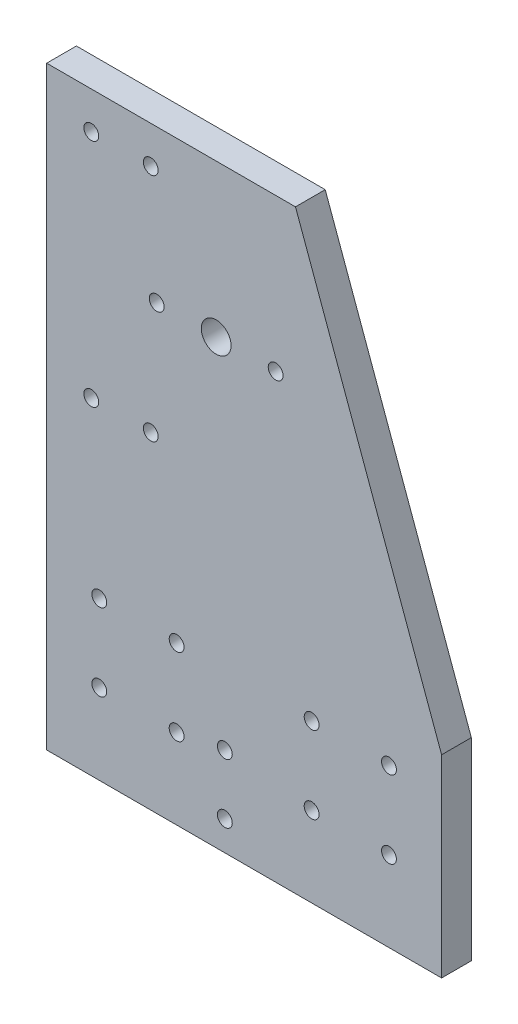
from build123d import *

# Parameters (mm, degrees)
SKETCH1_R           = 2.5
BOSS_EXTRUDE1_DEPTH = 10
SKETCH1_3_R         = 2.5
CUT_EXTRUDE1_DEPTH  = 5
SKETCH2_R           = 2.5
SKETCH2_R_2         = 5
CUT_EXTRUDE2_DEPTH  = 241.282833344


with BuildPart() as part:
    # Sketch1 → Boss-Extrude1 (new body)
    with BuildSketch(Plane.XY):
        Polygon((0, 200), (0, 0), (132.8, 0), (132.8, 65), (83.664018374, 200), align=None)
        with Locations((17.7, 27)):
            Circle(SKETCH1_R, mode=Mode.SUBTRACT)
        with Locations((43.7, 27)):
            Circle(SKETCH1_R, mode=Mode.SUBTRACT)
        with Locations((17.7, 53)):
            Circle(SKETCH1_R, mode=Mode.SUBTRACT)
        with Locations((43.7, 53)):
            Circle(SKETCH1_R, mode=Mode.SUBTRACT)
        with Locations((89.1, 27)):
            Circle(SKETCH1_R, mode=Mode.SUBTRACT)
        with Locations((115.1, 27)):
            Circle(SKETCH1_R, mode=Mode.SUBTRACT)
        with Locations((89.1, 53)):
            Circle(SKETCH1_R, mode=Mode.SUBTRACT)
        with Locations((115.1, 53)):
            Circle(SKETCH1_R, mode=Mode.SUBTRACT)
        with Locations((59.91, 9.92)):
            Circle(SKETCH1_R, mode=Mode.SUBTRACT)
        with Locations((59.91, 29.92)):
            Circle(SKETCH1_R, mode=Mode.SUBTRACT)
    extrude(amount=BOSS_EXTRUDE1_DEPTH)

    # Sketch1<3> → Cut-Extrude1 (cut)
    # profile 1 of 2: a face of its own
    with BuildSketch(Plane.XY):
        Polygon((62.2225, 25.914632507), (64.535, 29.92), (62.2225, 33.925367493), (57.5975, 33.925367493), (55.285, 29.92), (57.5975, 25.914632507), align=None)
        with Locations((59.91, 29.92)):
            Circle(SKETCH1_3_R, mode=Mode.SUBTRACT)
    # profile 2 of 2: a face of its own
    with BuildSketch(Plane.XY):
        Polygon((64.535, 9.92), (62.2225, 13.925367493), (57.5975, 13.925367493), (55.285, 9.92), (57.5975, 5.914632507), (62.2225, 5.914632507), align=None)
        with Locations((59.91, 9.92)):
            Circle(SKETCH1_3_R, mode=Mode.SUBTRACT)
    extrude(amount=CUT_EXTRUDE1_DEPTH, mode=Mode.SUBTRACT)

    # Sketch2 → Cut-Extrude2 (cut, through all)
    with BuildSketch(Plane(origin=(0, 0, 0), x_dir=(-1, 0, 0), z_dir=(0, 0, -1))):
        with Locations((-35, 187.5)):
            Circle(SKETCH2_R)
        with Locations((-15, 187.5)):
            Circle(SKETCH2_R)
        with Locations((-35, 110)):
            Circle(SKETCH2_R)
        with Locations((-15, 110)):
            Circle(SKETCH2_R)
        with Locations((-57, 148.75)):
            Circle(SKETCH2_R_2)
        with Locations((-77, 148.75)):
            Circle(SKETCH2_R)
        with Locations((-37, 148.75)):
            Circle(SKETCH2_R)
    extrude(amount=-CUT_EXTRUDE2_DEPTH, mode=Mode.SUBTRACT)


solid = part.part
